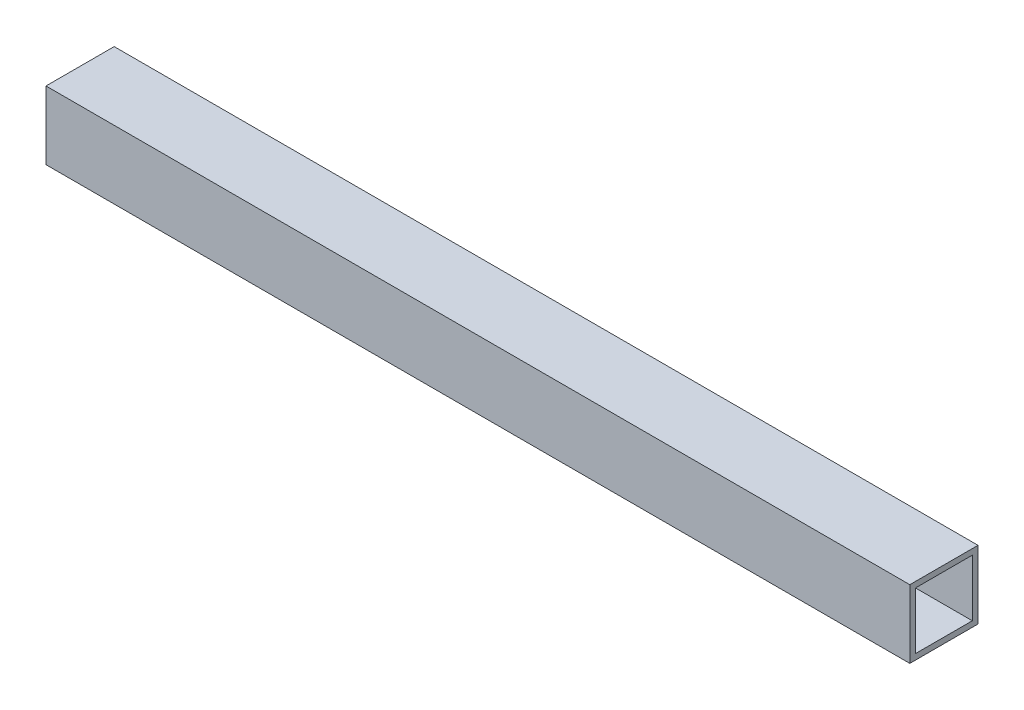
from build123d import *

# Parameters (mm, degrees)
SKETCH1_W           = 19.05
SKETCH1_H           = 19.05
SKETCH1_W_2         = 15.875
SKETCH1_H_2         = 15.875
BOSS_EXTRUDE1_DEPTH = 241.3


with BuildPart() as part:
    # Sketch1 → Boss-Extrude1 (new body)
    with BuildSketch(Plane(origin=(0, 0, 0), x_dir=(0, 0, -1), z_dir=(1, 0, 0))):
        Rectangle(SKETCH1_W, SKETCH1_H)
        Rectangle(SKETCH1_W_2, SKETCH1_H_2, mode=Mode.SUBTRACT)
    extrude(amount=BOSS_EXTRUDE1_DEPTH)


solid = part.part
